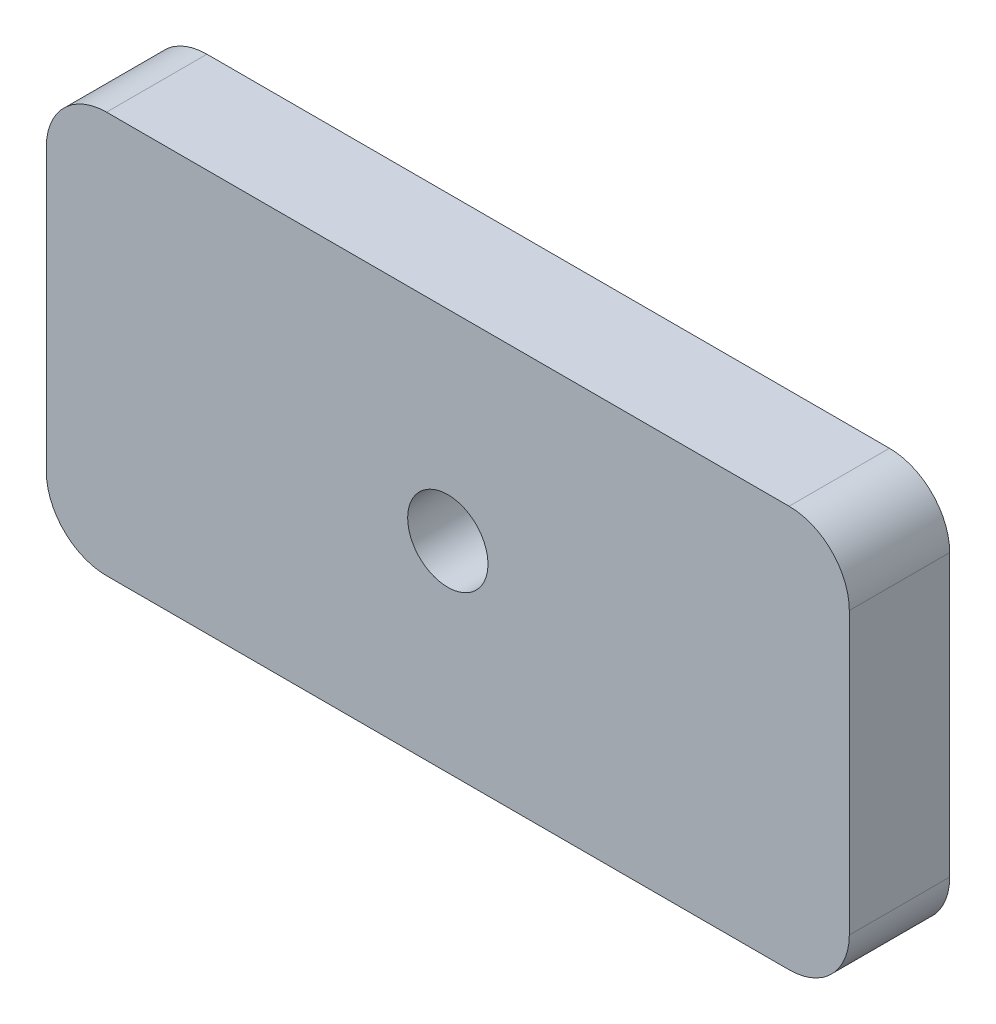
from build123d import *

# Parameters (mm, degrees)
BOSS_EXTRUDE1_DEPTH = 5
CUT_EXTRUDE1_REACH  = 24.913
SKETCH2_R           = 2


with BuildPart() as part:
    # Sketch1 → Boss-Extrude1 (new body)
    with BuildSketch(Plane.XY):
        with BuildLine():
            Line((17, 10), (-17, 10))
            ThreePointArc((-17, 10), (-19.121320344, 9.121320344), (-20, 7))
            Line((-20, 7), (-20, -7))
            ThreePointArc((-20, -7), (-19.121320344, -9.121320344), (-17, -10))
            Line((-17, -10), (17, -10))
            ThreePointArc((17, -10), (19.121320344, -9.121320344), (20, -7))
            Line((20, -7), (20, 7))
            ThreePointArc((20, 7), (19.121320344, 9.121320344), (17, 10))
        make_face()
    extrude(amount=BOSS_EXTRUDE1_DEPTH)

    # Sketch2 → Cut-Extrude1 (cut, up to next)
    with BuildSketch(Plane(origin=(0, 0, 0), x_dir=(-1, 0, 0), z_dir=(0, 0, -1)), mode=Mode.PRIVATE) as cut_extrude1_sk1:
        Circle(SKETCH2_R)
    cut_extrude1_tool1 = extrude(cut_extrude1_sk1.sketch, amount=-CUT_EXTRUDE1_REACH, mode=Mode.PRIVATE) & part.part
    add(cut_extrude1_tool1.solids().sort_by_distance((0, 0, 0))[0], mode=Mode.SUBTRACT)


solid = part.part
